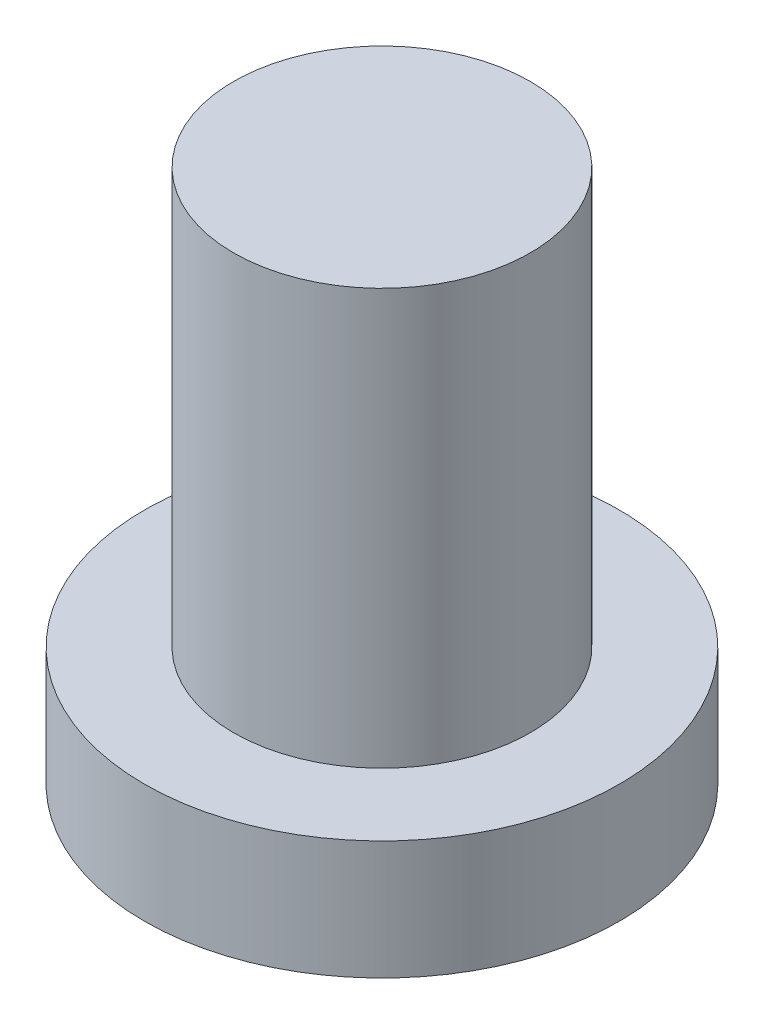
from build123d import *


with BuildPart() as part:
    # Esquisse1 → Base-Révolution (revolve)
    with BuildSketch(Plane(origin=(0, 0, 742.5), x_dir=(-1, 0, 0), z_dir=(0, 0, -1)), mode=Mode.PRIVATE) as base_r_volution_sk:
        Polygon((-2140, 625.49998798), (-2136.000000001, 625.49998798), (-2136.000000001, 634.49998798), (-2138.500000001, 634.49998798), (-2138.500000001, 627.49998798), (-2140, 627.49998798), align=None)
    revolve(base_r_volution_sk.sketch.rotate(Axis((2136.000000001, 625.499975959, 742.5), (0, 1, 0)), 270), axis=Axis((2136.000000001, 625.499975959, 742.5), (0, 1, 0)))


solid = part.part
